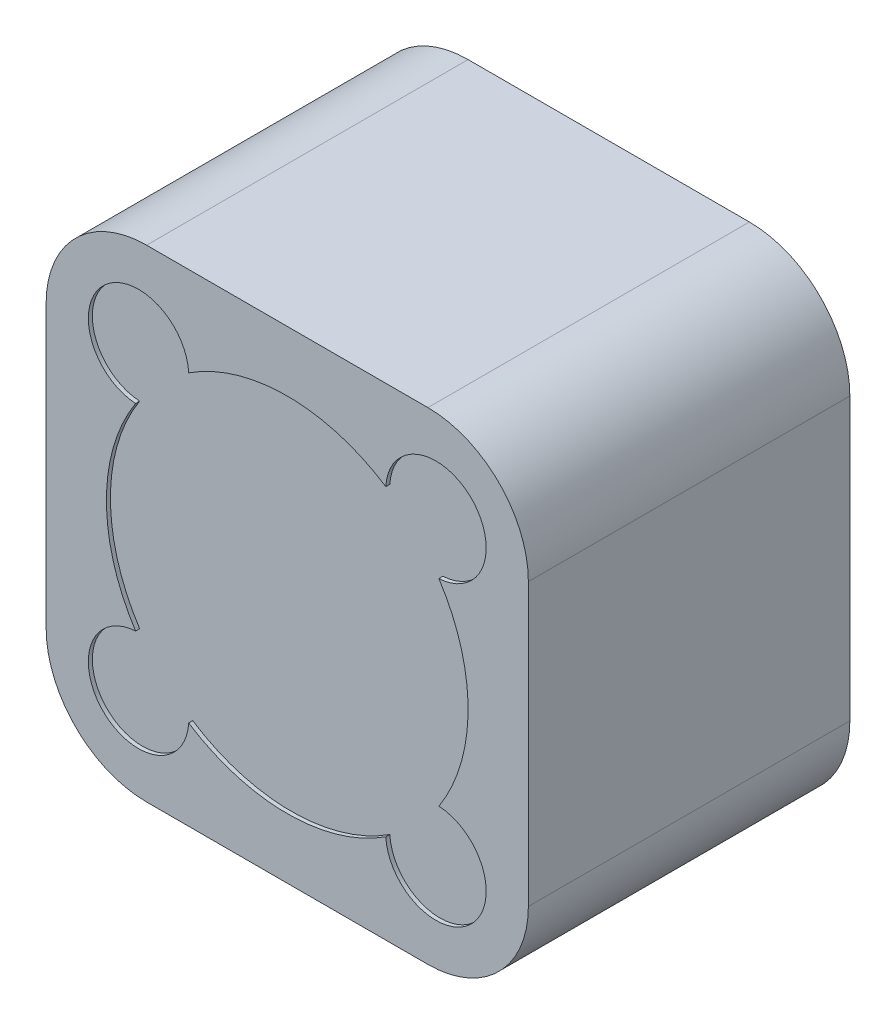
from build123d import *

# Parameters (mm, degrees)
SKETCH_1_W               = 12
SKETCH_1_H               = 12
EXTRUDE_1_DEPTH          = 8
FILLET_1_R               = 2.5
SKETCH_2_R               = 4.5
CUT_EXTRUDE_1_DEPTH      = 0.1
SKETCH_3_R               = 1.25
CUT_EXTRUDE_2_DEPTH      = 0.1
PATTERN_CIRCULAR_1_COUNT = 4


with BuildPart() as part:
    # Эскиз1 → Бобышка-Вытянуть1 (new body)
    with BuildSketch(Plane.XY):
        Rectangle(SKETCH_1_W, SKETCH_1_H)
    extrude(amount=EXTRUDE_1_DEPTH)

    # Скругление1
    fillet_1_edges = [part.edges().sort_by_distance(p)[0] for p in [
        (-6, 6, 4),
        (6, 6, 4),
        (-6, -6, 4),
        (6, -6, 4),
    ]]
    fillet(fillet_1_edges, radius=FILLET_1_R)

    # Эскиз2 → Вырез-Вытянуть1 (cut)
    with BuildSketch(Plane.XY.offset(8)):
        Circle(SKETCH_2_R)
    extrude(amount=-CUT_EXTRUDE_1_DEPTH, mode=Mode.SUBTRACT)

    # Эскиз3 → Вырез-Вытянуть2 (cut)
    with BuildSketch(Plane.XY.offset(8)):
        with Locations((-3.7, -3.7)):
            Circle(SKETCH_3_R)
    cut_extrude_2 = extrude(amount=-CUT_EXTRUDE_2_DEPTH, mode=Mode.SUBTRACT)

    # Круговой массив1: Вырез-Вытянуть2 ×4 about axis
    pattern_circular_1_axis = Axis((0, 0, -0.4), (0, 0, 1))
    for i in range(1, PATTERN_CIRCULAR_1_COUNT):
        add(cut_extrude_2.rotate(pattern_circular_1_axis, i * 360 / PATTERN_CIRCULAR_1_COUNT), mode=Mode.SUBTRACT)


solid = part.part
